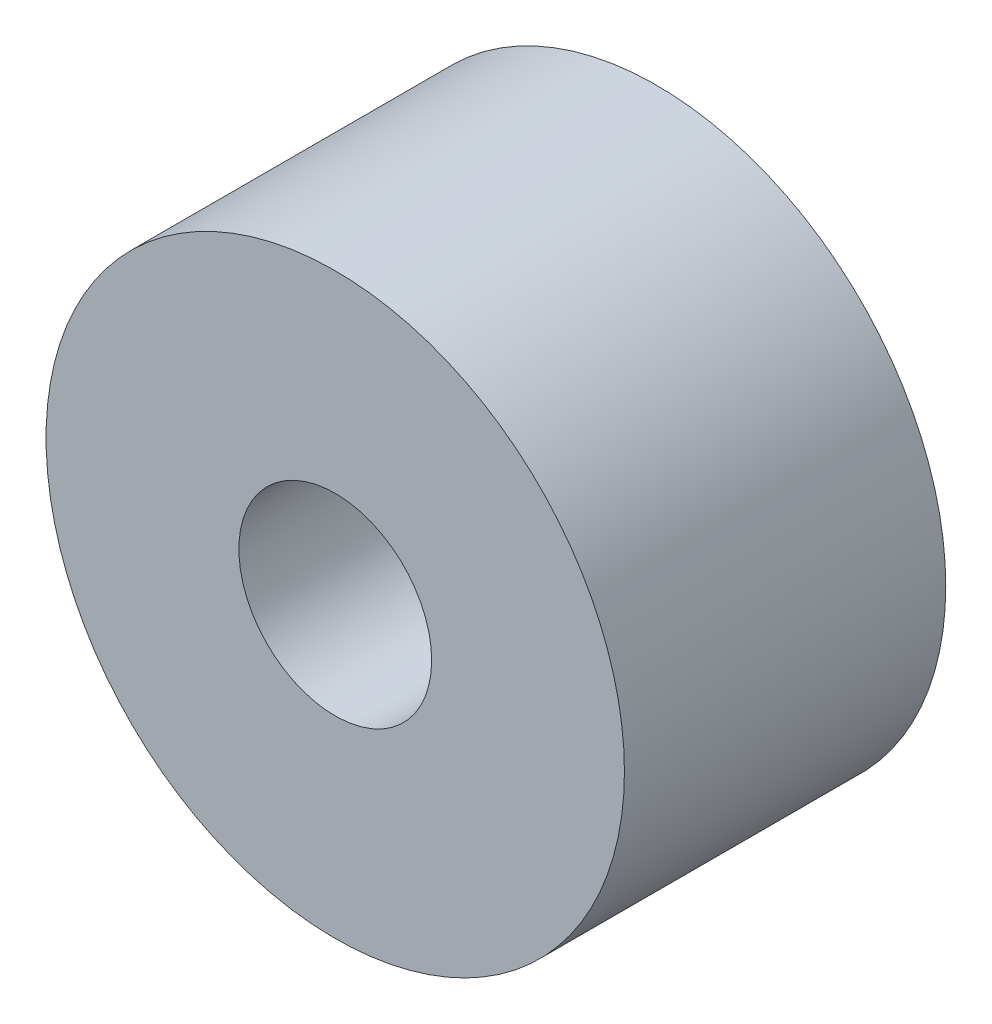
from build123d import *

# Parameters (mm, degrees)
SKETCH1_R           = 2.25
SKETCH1_R_2         = 0.75
BOSS_EXTRUDE1_DEPTH = 2.5


with BuildPart() as part:
    # Sketch1 → Boss-Extrude1 (new body)
    with BuildSketch(Plane.XY):
        Circle(SKETCH1_R)
        Circle(SKETCH1_R_2, mode=Mode.SUBTRACT)
    extrude(amount=BOSS_EXTRUDE1_DEPTH)


solid = part.part
